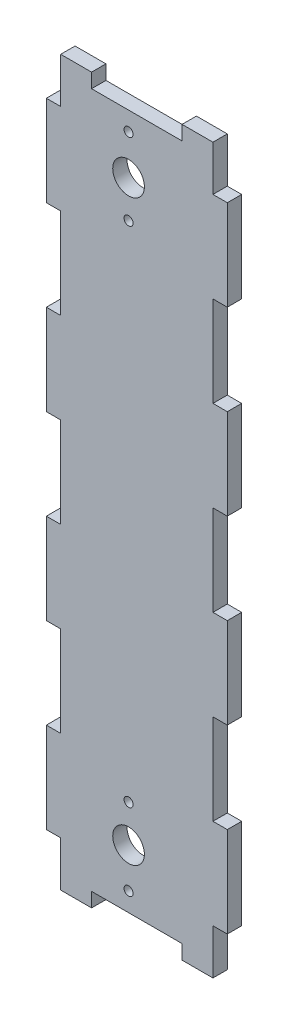
from build123d import *

# Parameters (mm, degrees)
SKETCH1_W           = 40
SKETCH1_H           = 160
BOSS_EXTRUDE1_DEPTH = 3.175
SKETCH2_W           = 3.175
SKETCH2_H           = 10
SKETCH2_H_2         = 20
CUT_EXTRUDE1_DEPTH  = 3.175
SKETCH3_R           = 1
CUT_EXTRUDE2_DEPTH  = 3.175
SKETCH4_W           = 20
SKETCH4_H           = 3.175
CUT_EXTRUDE3_DEPTH  = 3.175
SKETCH5_R           = 3.5
CUT_EXTRUDE4_DEPTH  = 3.175


with BuildPart() as part:
    # Sketch1 → Boss-Extrude1 (new body)
    with BuildSketch(Plane(origin=(0, 0, -55.956765442), x_dir=(-1, 0, 0), z_dir=(0, 0, -1))):
        with Locations((-25.376465458, 105.316281379)):
            Rectangle(SKETCH1_W, SKETCH1_H)
    extrude(amount=-BOSS_EXTRUDE1_DEPTH)

    # Sketch2 → Cut-Extrude1 (cut)
    with BuildSketch(Plane(origin=(0, 0, -55.956765442), x_dir=(-1, 0, 0), z_dir=(0, 0, -1))):
        with Locations((-6.963965458, 180.316281379)):
            Rectangle(SKETCH2_W, SKETCH2_H)
        with Locations((-6.963965458, 145.316281379)):
            Rectangle(SKETCH2_W, SKETCH2_H_2)
        with Locations((-6.963965458, 105.316281379)):
            Rectangle(SKETCH2_W, SKETCH2_H_2)
        with Locations((-6.963965458, 65.316281379)):
            Rectangle(SKETCH2_W, SKETCH2_H_2)
        with Locations((-6.963965458, 30.316281379)):
            Rectangle(SKETCH2_W, SKETCH2_H)
    cut_extrude1 = extrude(amount=-CUT_EXTRUDE1_DEPTH, mode=Mode.SUBTRACT)

    # Sketch3 → Cut-Extrude2 (cut)
    with BuildSketch(Plane(origin=(0, 0, -55.956765442), x_dir=(-1, 0, 0), z_dir=(0, 0, -1))):
        with Locations((-23.551465458, 32.666436233)):
            Circle(SKETCH3_R)
        with Locations((-23.551465458, 49.666436233)):
            Circle(SKETCH3_R)
    cut_extrude2 = extrude(amount=-CUT_EXTRUDE2_DEPTH, mode=Mode.SUBTRACT)

    # Mirror1: Cut-Extrude1 across plane
    add(cut_extrude1.mirror(Plane.ZY.offset(-25.376465458)), mode=Mode.SUBTRACT)

    # Sketch4 → Cut-Extrude3 (cut)
    with BuildSketch(Plane(origin=(0, 0, -55.956765442), x_dir=(-1, 0, 0), z_dir=(0, 0, -1))):
        with Locations((-25.376465458, 26.903781379)):
            Rectangle(SKETCH4_W, SKETCH4_H)
        with Locations((-25.376465458, 183.728781379)):
            Rectangle(SKETCH4_W, SKETCH4_H)
    extrude(amount=-CUT_EXTRUDE3_DEPTH, mode=Mode.SUBTRACT)

    # Sketch5 → Cut-Extrude4 (cut)
    with BuildSketch(Plane(origin=(0, 0, -55.956765442), x_dir=(-1, 0, 0), z_dir=(0, 0, -1))):
        with Locations((-23.551465458, 41.425244037)):
            Circle(SKETCH5_R)
    cut_extrude4 = extrude(amount=-CUT_EXTRUDE4_DEPTH, mode=Mode.SUBTRACT)

    # Mirror2: Cut-Extrude2, Cut-Extrude4 across plane
    add(cut_extrude2.mirror(Plane(origin=(0, 105.316281379, 0), x_dir=(0, 0, 1), z_dir=(0, -1, 0))), mode=Mode.SUBTRACT)
    add(cut_extrude4.mirror(Plane(origin=(0, 105.316281379, 0), x_dir=(0, 0, 1), z_dir=(0, -1, 0))), mode=Mode.SUBTRACT)


solid = part.part
